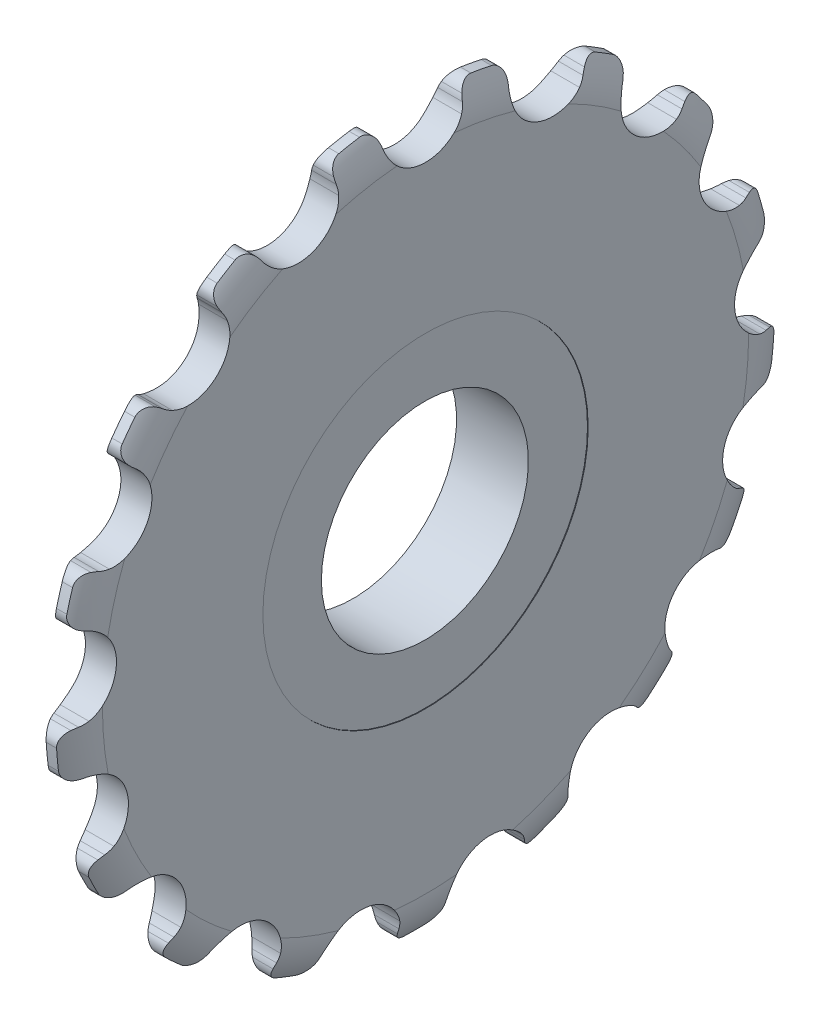
from build123d import *

# Parameters (mm, degrees)
ESQUISSE7_R             = 46.466585447
ENL_V_MAT_EXTRU_1_DEPTH = 50.589551238
CONG_1_R                = 0.25
SKETCH3_W               = 6.94
SKETCH3_H               = 5.71


with BuildPart() as part:
    # Esquisse1 → Révolution1 (revolve)
    with BuildSketch(Plane.XY, mode=Mode.PRIVATE) as r_volution1_sk:
        with BuildLine():
            Line((0, 15.714), (0, 17.714))
            Line((0, 17.714), (1.377769907, 17.714))
            ThreePointArc((1.377769907, 17.714), (2.29052391, 17.922735838), (3.021826035, 18.507447495))
            ThreePointArc((3.021826035, 18.507447495), (3.350295613, 19.07530015), (3.5, 19.714))
            Line((3.5, 19.714), (4, 25.714))
            Line((4, 25.714), (4, 31.214))
            ThreePointArc((4, 31.214), (4.254903847, 33.034027472), (5, 34.714))
            Line((5, 34.714), (6, 34.714))
            ThreePointArc((6, 34.714), (6.745096153, 33.034027472), (7, 31.214))
            Line((7, 31.214), (7, 15.714))
            Line((7, 15.714), (0, 15.714))
        make_face()
    revolve(r_volution1_sk.sketch.rotate(Axis((0, 0, 0), (1, 0, 0)), 90), axis=Axis((0, 0, 0), (1, 0, 0)))

    # Esquisse7 → Enlèv. mat.-Extru.1 (cut, through all)
    with BuildSketch(Plane(origin=(7, 0, 0), x_dir=(0, 0, -1), z_dir=(1, 0, 0))):
        Circle(ESQUISSE7_R)
        with BuildLine():
            ThreePointArc((8.281095667, 31.329253867), (10.837249986, 27.974166882), (14.986578307, 28.731536053))
            ThreePointArc((14.986578307, 28.731536053), (15.277889743, 29.031756316), (15.524607879, 29.36957982))
            ThreePointArc((15.524607879, 29.36957982), (15.681932568, 29.595698304), (15.859731442, 29.806098368))
            ThreePointArc((15.859731442, 29.806098368), (16.59056175, 30.191661629), (17.402263791, 30.037027332))
            ThreePointArc((17.402263791, 30.037027332), (18.274566102, 29.51443765), (19.1311878, 28.966522907))
            ThreePointArc((19.1311878, 28.966522907), (19.631417479, 28.308843475), (19.612034501, 27.482770676))
            ThreePointArc((19.612034501, 27.482770676), (19.502943865, 27.229828273), (19.370656547, 26.988207305))
            ThreePointArc((19.370656547, 26.988207305), (19.178221084, 26.616773393), (19.039323606, 26.222182403))
            ThreePointArc((19.039323606, 26.222182403), (20.210869309, 22.170267517), (24.353596041, 21.37758296))
            ThreePointArc((24.353596041, 21.37758296), (24.733687933, 21.552296189), (25.085781669, 21.778182354))
            ThreePointArc((25.085781669, 21.778182354), (25.31416599, 21.932199328), (25.555963773, 22.064163183))
            ThreePointArc((25.555963773, 22.064163183), (26.376724254, 22.159683859), (27.077753514, 21.722271074))
            ThreePointArc((27.077753514, 21.722271074), (27.702370028, 20.919858767), (28.303216338, 20.099496036))
            ThreePointArc((28.303216338, 20.099496036), (28.532085408, 19.305524427), (28.215599405, 18.542236422))
            ThreePointArc((28.215599405, 18.542236422), (28.022502081, 18.345782738), (27.81186427, 18.168265587))
            ThreePointArc((27.81186427, 18.168265587), (27.498246139, 17.891429486), (27.226185391, 17.573659902))
            ThreePointArc((27.226185391, 17.573659902), (26.854898741, 13.372150673), (30.431525682, 11.13646883))
            ThreePointArc((30.431525682, 11.13646883), (30.849064514, 11.162079036), (31.25898164, 11.245520684))
            ThreePointArc((31.25898164, 11.245520684), (31.527581025, 11.306635303), (31.800721585, 11.342340499))
            ThreePointArc((31.800721585, 11.342340499), (32.600563989, 11.134917992), (33.096242583, 10.47380174))
            ThreePointArc((33.096242583, 10.47380174), (33.388815377, 9.499937037), (33.652738676, 8.51792085))
            ThreePointArc((33.652738676, 8.51792085), (33.5793371, 7.69488733), (33.008491261, 7.097470393))
            ThreePointArc((33.008491261, 7.097470393), (32.757466113, 6.984037587), (32.496925612, 6.894598928))
            ThreePointArc((32.496925612, 6.894598928), (32.10448068, 6.749748888), (31.735999974, 6.551717253))
            ThreePointArc((31.735999974, 6.551717253), (29.872025289, 2.768050784), (32.399509152, -0.608687124))
            ThreePointArc((32.399509152, -0.608687124), (32.798103991, -0.735638742), (33.210482928, -0.805910867))
            ThreePointArc((33.210482928, -0.805910867), (33.483021542, -0.845952472), (33.750615733, -0.911328119))
            ThreePointArc((33.750615733, -0.911328119), (34.421516911, -1.393680249), (34.644900698, -2.189212556))
            ThreePointArc((34.644900698, -2.189212556), (34.565916196, -3.20300383), (34.457272179, -4.214046746))
            ThreePointArc((34.457272179, -4.214046746), (34.091513248, -4.95498694), (33.343403466, -5.305848341))
            ThreePointArc((33.343403466, -5.305848341), (33.068352831, -5.320940539), (32.793097079, -5.310221521))
            ThreePointArc((32.793097079, -5.310221521), (32.374827208, -5.303522699), (31.959691905, -5.355071115))
            ThreePointArc((31.959691905, -5.355071115), (28.854769295, -8.209889702), (29.99175938, -12.271636509))
            ThreePointArc((29.99175938, -12.271636509), (30.317577784, -12.534004431), (30.676724471, -12.748499691))
            ThreePointArc((30.676724471, -12.748499691), (30.916394464, -12.884289679), (31.142302208, -13.041916826))
            ThreePointArc((31.142302208, -13.041916826), (31.593653238, -13.734054251), (31.514573, -14.556561566))
            ThreePointArc((31.514573, -14.556561566), (31.074698496, -15.473361282), (30.60816014, -16.376883978))
            ThreePointArc((30.60816014, -16.376883978), (29.999441624, -16.935662767), (29.175104271, -16.992582855))
            ThreePointArc((29.175104271, -16.992582855), (28.913175261, -16.907296162), (28.660379072, -16.797867128))
            ThreePointArc((28.660379072, -16.797867128), (28.272773927, -16.640524158), (27.86705035, -16.538627456))
            ThreePointArc((27.86705035, -16.538627456), (23.940516818, -18.079039091), (23.533456313, -22.277233385))
            ThreePointArc((23.533456313, -22.277233385), (23.742494702, -22.639583369), (23.999904388, -22.969332989))
            ThreePointArc((23.999904388, -22.969332989), (24.174337, -23.18253217), (24.328048205, -23.411122397))
            ThreePointArc((24.328048205, -23.411122397), (24.498891629, -24.219568123), (24.12802759, -24.957966276))
            ThreePointArc((24.12802759, -24.957966276), (23.386670574, -25.653955552), (22.625246469, -26.327932282))
            ThreePointArc((22.625246469, -26.327932282), (21.855779176, -26.629083494), (21.066545579, -26.384374897))
            ThreePointArc((21.066545579, -26.384374897), (20.853113158, -26.210227751), (20.656918059, -26.0168677))
            ThreePointArc((20.656918059, -26.0168677), (20.352325862, -25.730130622), (20.010809228, -25.488550515))
            ThreePointArc((20.010809228, -25.488550515), (15.792964886, -25.506514072), (13.896829568, -29.274166449))
            ThreePointArc((13.896829568, -29.274166449), (13.960856148, -29.687561122), (14.08176423, -30.08803059))
            ThreePointArc((14.08176423, -30.08803059), (14.167401369, -30.349845232), (14.228156484, -30.618526163))
            ThreePointArc((14.228156484, -30.618526163), (14.095418952, -31.434095114), (13.482858356, -31.988659343))
            ThreePointArc((13.482858356, -31.988659343), (12.5401432, -32.369840972), (11.586667891, -32.723247443))
            ThreePointArc((11.586667891, -32.723247443), (10.760372643, -32.726098938), (10.112833173, -32.212810907))
            ThreePointArc((10.112833173, -32.212810907), (9.976722573, -31.973322847), (9.863625798, -31.722146124))
            ThreePointArc((9.863625798, -31.722146124), (9.683183413, -31.344740369), (9.451997436, -30.996103591))
            ThreePointArc((9.451997436, -30.996103591), (5.512485534, -29.489192991), (2.383358985, -32.317461121))
            ThreePointArc((2.383358985, -32.317461121), (2.293726612, -32.726069242), (2.261803783, -33.143172936))
            ThreePointArc((2.261803783, -33.143172936), (2.247079679, -33.418243522), (2.20667339, -33.690728307))
            ThreePointArc((2.20667339, -33.690728307), (1.78828184, -34.403273379), (1.01675439, -34.699106711))
            ThreePointArc((1.01675439, -34.699106711), (0, -34.714), (-1.01675439, -34.699106711))
            ThreePointArc((-1.01675439, -34.699106711), (-1.78828184, -34.403273379), (-2.20667339, -33.690728307))
            ThreePointArc((-2.20667339, -33.690728307), (-2.247079679, -33.418243522), (-2.261803783, -33.143172936))
            ThreePointArc((-2.261803783, -33.143172936), (-2.293726612, -32.726069242), (-2.383358985, -32.317461121))
            ThreePointArc((-2.383358985, -32.317461121), (-5.512485534, -29.489192991), (-9.451997436, -30.996103591))
            ThreePointArc((-9.451997436, -30.996103591), (-9.683183413, -31.344740369), (-9.863625798, -31.722146124))
            ThreePointArc((-9.863625798, -31.722146124), (-9.976722573, -31.973322847), (-10.112833173, -32.212810907))
            ThreePointArc((-10.112833173, -32.212810907), (-10.760372643, -32.726098938), (-11.586667891, -32.723247443))
            ThreePointArc((-11.586667891, -32.723247443), (-12.5401432, -32.369840972), (-13.482858356, -31.988659343))
            ThreePointArc((-13.482858356, -31.988659343), (-14.095418952, -31.434095114), (-14.228156484, -30.618526163))
            ThreePointArc((-14.228156484, -30.618526163), (-14.167401369, -30.349845232), (-14.08176423, -30.08803059))
            ThreePointArc((-14.08176423, -30.08803059), (-13.960856148, -29.687561122), (-13.896829568, -29.274166449))
            ThreePointArc((-13.896829568, -29.274166449), (-15.792964886, -25.506514072), (-20.010809228, -25.488550515))
            ThreePointArc((-20.010809228, -25.488550515), (-20.352325862, -25.730130622), (-20.656918059, -26.0168677))
            ThreePointArc((-20.656918059, -26.0168677), (-20.853113158, -26.210227751), (-21.066545579, -26.384374897))
            ThreePointArc((-21.066545579, -26.384374897), (-21.855779176, -26.629083494), (-22.625246469, -26.327932282))
            ThreePointArc((-22.625246469, -26.327932282), (-23.386670574, -25.653955552), (-24.12802759, -24.957966276))
            ThreePointArc((-24.12802759, -24.957966276), (-24.498891629, -24.219568123), (-24.328048205, -23.411122397))
            ThreePointArc((-24.328048205, -23.411122397), (-24.174337, -23.18253217), (-23.999904388, -22.969332989))
            ThreePointArc((-23.999904388, -22.969332989), (-23.742494702, -22.639583369), (-23.533456313, -22.277233385))
            ThreePointArc((-23.533456313, -22.277233385), (-23.940516818, -18.079039091), (-27.86705035, -16.538627456))
            ThreePointArc((-27.86705035, -16.538627456), (-28.272773927, -16.640524158), (-28.660379072, -16.797867128))
            ThreePointArc((-28.660379072, -16.797867128), (-28.913175261, -16.907296162), (-29.175104271, -16.992582855))
            ThreePointArc((-29.175104271, -16.992582855), (-29.999441624, -16.935662767), (-30.60816014, -16.376883978))
            ThreePointArc((-30.60816014, -16.376883978), (-31.074698496, -15.473361282), (-31.514573, -14.556561566))
            ThreePointArc((-31.514573, -14.556561566), (-31.593653238, -13.734054251), (-31.142302208, -13.041916826))
            ThreePointArc((-31.142302208, -13.041916826), (-30.916394464, -12.884289679), (-30.676724471, -12.748499691))
            ThreePointArc((-30.676724471, -12.748499691), (-30.317577784, -12.534004431), (-29.99175938, -12.271636509))
            ThreePointArc((-29.99175938, -12.271636509), (-28.854769295, -8.209889702), (-31.959691905, -5.355071115))
            ThreePointArc((-31.959691905, -5.355071115), (-32.374827208, -5.303522699), (-32.793097079, -5.310221521))
            ThreePointArc((-32.793097079, -5.310221521), (-33.068352831, -5.320940539), (-33.343403466, -5.305848341))
            ThreePointArc((-33.343403466, -5.305848341), (-34.091513248, -4.95498694), (-34.457272179, -4.214046746))
            ThreePointArc((-34.457272179, -4.214046746), (-34.565916196, -3.20300383), (-34.644900698, -2.189212556))
            ThreePointArc((-34.644900698, -2.189212556), (-34.421516911, -1.393680249), (-33.750615733, -0.911328119))
            ThreePointArc((-33.750615733, -0.911328119), (-33.483021542, -0.845952472), (-33.210482928, -0.805910867))
            ThreePointArc((-33.210482928, -0.805910867), (-32.798103991, -0.735638742), (-32.399509152, -0.608687124))
            ThreePointArc((-32.399509152, -0.608687124), (-29.872025289, 2.768050784), (-31.735999974, 6.551717253))
            ThreePointArc((-31.735999974, 6.551717253), (-32.10448068, 6.749748888), (-32.496925612, 6.894598928))
            ThreePointArc((-32.496925612, 6.894598928), (-32.757466113, 6.984037587), (-33.008491261, 7.097470393))
            ThreePointArc((-33.008491261, 7.097470393), (-33.5793371, 7.69488733), (-33.652738676, 8.51792085))
            ThreePointArc((-33.652738676, 8.51792085), (-33.388815377, 9.499937037), (-33.096242583, 10.47380174))
            ThreePointArc((-33.096242583, 10.47380174), (-32.600563989, 11.134917992), (-31.800721585, 11.342340499))
            ThreePointArc((-31.800721585, 11.342340499), (-31.527581025, 11.306635303), (-31.25898164, 11.245520684))
            ThreePointArc((-31.25898164, 11.245520684), (-30.849064514, 11.162079036), (-30.431525682, 11.13646883))
            ThreePointArc((-30.431525682, 11.13646883), (-26.854898741, 13.372150673), (-27.226185391, 17.573659902))
            ThreePointArc((-27.226185391, 17.573659902), (-27.498246139, 17.891429486), (-27.81186427, 18.168265587))
            ThreePointArc((-27.81186427, 18.168265587), (-28.022502081, 18.345782738), (-28.215599405, 18.542236422))
            ThreePointArc((-28.215599405, 18.542236422), (-28.532085408, 19.305524427), (-28.303216338, 20.099496036))
            ThreePointArc((-28.303216338, 20.099496036), (-27.702370028, 20.919858767), (-27.077753514, 21.722271074))
            ThreePointArc((-27.077753514, 21.722271074), (-26.376724254, 22.159683859), (-25.555963773, 22.064163183))
            ThreePointArc((-25.555963773, 22.064163183), (-25.31416599, 21.932199328), (-25.085781669, 21.778182354))
            ThreePointArc((-25.085781669, 21.778182354), (-24.733687933, 21.552296189), (-24.353596041, 21.37758296))
            ThreePointArc((-24.353596041, 21.37758296), (-20.210869309, 22.170267517), (-19.039323606, 26.222182403))
            ThreePointArc((-19.039323606, 26.222182403), (-19.178221084, 26.616773393), (-19.370656547, 26.988207305))
            ThreePointArc((-19.370656547, 26.988207305), (-19.502943865, 27.229828273), (-19.612034501, 27.482770676))
            ThreePointArc((-19.612034501, 27.482770676), (-19.631417479, 28.308843475), (-19.1311878, 28.966522907))
            ThreePointArc((-19.1311878, 28.966522907), (-18.274566102, 29.51443765), (-17.402263791, 30.037027332))
            ThreePointArc((-17.402263791, 30.037027332), (-16.59056175, 30.191661629), (-15.859731442, 29.806098368))
            ThreePointArc((-15.859731442, 29.806098368), (-15.681932568, 29.595698304), (-15.524607879, 29.36957982))
            ThreePointArc((-15.524607879, 29.36957982), (-15.277889743, 29.031756316), (-14.986578307, 28.731536053))
            ThreePointArc((-14.986578307, 28.731536053), (-10.837249986, 27.974166882), (-8.281095667, 31.329253867))
            ThreePointArc((-8.281095667, 31.329253867), (-8.268071001, 31.747374564), (-8.313334321, 32.16324208))
            ThreePointArc((-8.313334321, 32.16324208), (-8.349405011, 32.436334613), (-8.359755664, 32.711604463))
            ThreePointArc((-8.359755664, 32.711604463), (-8.079417838, 33.488896346), (-7.375386341, 33.921460351))
            ThreePointArc((-7.375386341, 33.921460351), (-6.378680761, 34.122928182), (-5.376501913, 34.295116608))
            ThreePointArc((-5.376501913, 34.295116608), (-4.563751951, 34.146088198), (-4.021554499, 33.522554806))
            ThreePointArc((-4.021554499, 33.522554806), (-3.931767256, 33.262134228), (-3.866749771, 32.994452789))
            ThreePointArc((-3.866749771, 32.994452789), (-3.758727885, 32.590316882), (-3.595540129, 32.205135996))
            ThreePointArc((-3.595540129, 32.205135996), (0, 30), (3.595540129, 32.205135996))
            ThreePointArc((3.595540129, 32.205135996), (3.758727885, 32.590316882), (3.866749771, 32.994452789))
            ThreePointArc((3.866749771, 32.994452789), (3.931767256, 33.262134228), (4.021554499, 33.522554806))
            ThreePointArc((4.021554499, 33.522554806), (4.563751951, 34.146088198), (5.376501913, 34.295116608))
            ThreePointArc((5.376501913, 34.295116608), (6.378680761, 34.122928182), (7.375386341, 33.921460351))
            ThreePointArc((7.375386341, 33.921460351), (8.079417838, 33.488896346), (8.359755664, 32.711604463))
            ThreePointArc((8.359755664, 32.711604463), (8.349405011, 32.436334613), (8.313334321, 32.16324208))
            ThreePointArc((8.313334321, 32.16324208), (8.268071001, 31.747374564), (8.281095667, 31.329253867))
        make_face(mode=Mode.SUBTRACT)
    extrude(amount=-ENL_V_MAT_EXTRU_1_DEPTH, mode=Mode.SUBTRACT)

    # Congé1
    cong_1_edges = [part.edges().sort_by_distance(p)[0] for p in [
        (0, 0, -17.714),
    ]]
    fillet(cong_1_edges, radius=CONG_1_R)


with BuildPart() as body_2:
    # Sketch3 → Revolve1 (revolve)
    with BuildSketch(Plane.XY, mode=Mode.PRIVATE) as revolve1_sk:
        with Locations((3.47, 12.855)):
            Rectangle(SKETCH3_W, SKETCH3_H)
    revolve(revolve1_sk.sketch.rotate(Axis((0, 0, 0), (1, 0, 0)), 90), axis=Axis((0, 0, 0), (1, 0, 0)))


solid = Compound([part.part, body_2.part])
